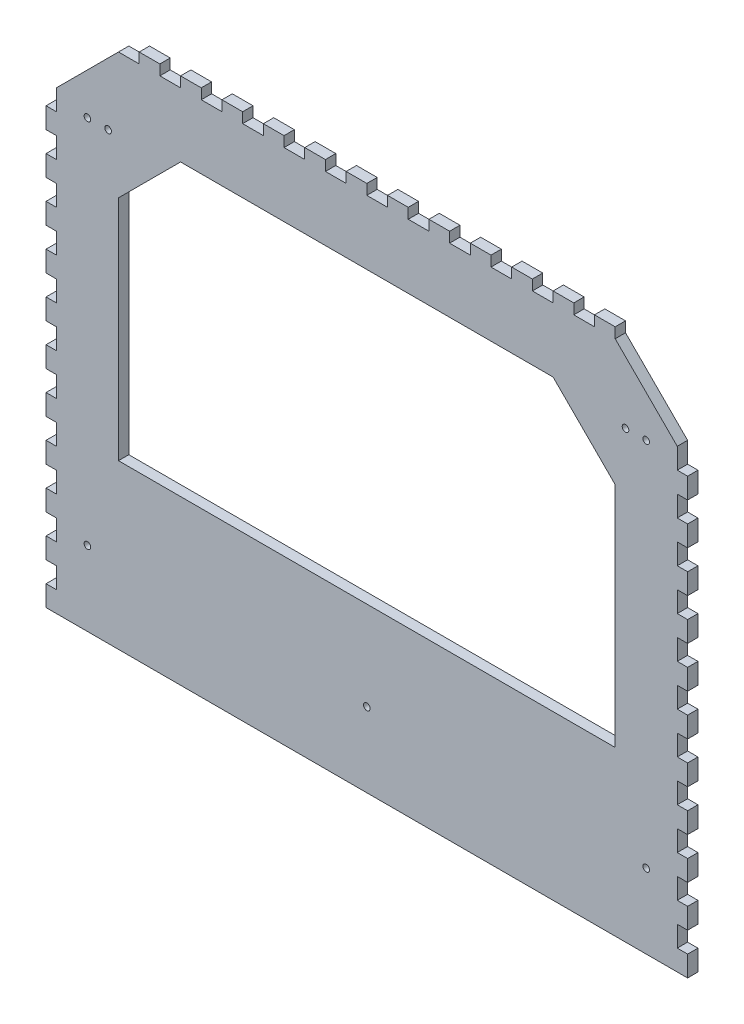
from build123d import *

# Parameters (mm, degrees)
SKIZZE1_R                       = 1.6
AUFSATZ_LINEAR_AUSTRAGEN1_DEPTH = 5


with BuildPart() as part:
    # Skizze1 → Aufsatz-Linear austragen1 (new body)
    with BuildSketch(Plane.XY):
        Polygon((5, 10), (5, 20), (0, 20), (0, 30), (5, 30), (5, 40), (0, 40), (0, 50), (5, 50), (5, 60), (0, 60), (0, 70), (5, 70), (5, 80), (0, 80), (0, 90), (5, 90), (5, 100), (0, 100), (0, 110), (5, 110), (5, 120), (0, 120), (0, 130), (5, 130), (5, 140), (0, 140), (0, 150), (5, 150), (5, 160), (0, 160), (0, 170), (5, 170), (5, 180), (0, 180), (0, 190), (5, 190), (5, 200), (0, 200), (0, 210), (5, 210), (5, 220), (35, 250), (45, 250), (45, 255), (55, 255), (55, 250), (65, 250), (65, 255), (75, 255), (75, 250), (85, 250), (85, 255), (95, 255), (95, 250), (105, 250), (105, 255), (115, 255), (115, 250), (125, 250), (125, 255), (135, 255), (135, 250), (145, 250), (145, 255), (155, 255), (155, 250), (165, 250), (165, 255), (175, 255), (175, 250), (185, 250), (185, 255), (195, 255), (195, 250), (205, 250), (205, 255), (215, 255), (215, 250), (225, 250), (225, 255), (235, 255), (235, 250), (245, 250), (245, 255), (255, 255), (255, 250), (265, 250), (265, 255), (275, 255), (275, 250), (305, 220), (305, 210), (310, 210), (310, 200), (305, 200), (305, 190), (310, 190), (310, 180), (305, 180), (305, 170), (310, 170), (310, 160), (305, 160), (305, 150), (310, 150), (310, 140), (305, 140), (305, 130), (310, 130), (310, 120), (305, 120), (305, 110), (310, 110), (310, 100), (305, 100), (305, 90), (310, 90), (310, 80), (305, 80), (305, 70), (310, 70), (310, 60), (305, 60), (305, 50), (310, 50), (310, 40), (305, 40), (305, 30), (310, 30), (310, 20), (305, 20), (305, 10), (310, 10), (310, 0), (305, 0), (5, 0), (0, 0), (0, 10), align=None)
        with Locations((290, 214.999999999)):
            Circle(SKIZZE1_R, mode=Mode.SUBTRACT)
        with Locations((280, 214.999999999)):
            Circle(SKIZZE1_R, mode=Mode.SUBTRACT)
        with Locations((20, 215)):
            Circle(SKIZZE1_R, mode=Mode.SUBTRACT)
        with Locations((30, 215)):
            Circle(SKIZZE1_R, mode=Mode.SUBTRACT)
        with Locations((20, 36)):
            Circle(SKIZZE1_R, mode=Mode.SUBTRACT)
        with Locations((155, 36)):
            Circle(SKIZZE1_R, mode=Mode.SUBTRACT)
        with Locations((290, 36)):
            Circle(SKIZZE1_R, mode=Mode.SUBTRACT)
        Polygon((275, 188.971165398), (245, 218.971165398), (65, 218.971165398), (35, 188.971165398), (35, 78.971165398), (275, 78.971165398), align=None, mode=Mode.SUBTRACT)
    extrude(amount=AUFSATZ_LINEAR_AUSTRAGEN1_DEPTH)


solid = part.part
